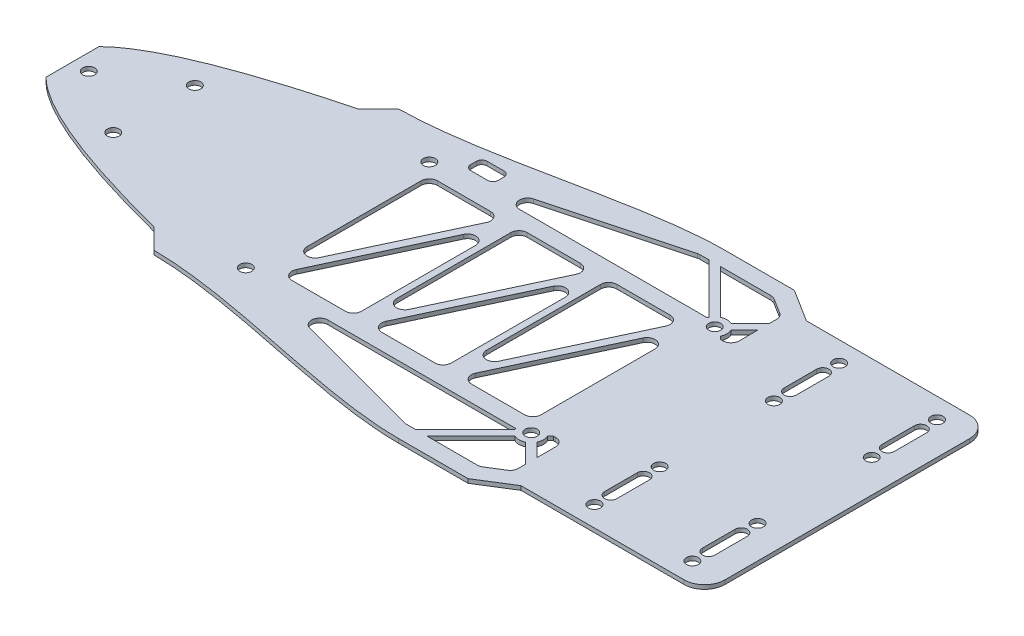
from build123d import *

# Parameters (mm, degrees)
EXTRUDE_2378_DEPTH     = 1
CUT_EXTRUDE_3502_DEPTH = 104.082491239
SKETCH_3_R             = 1.475
CUT_EXTRUDE_3584_DEPTH = 104.082491371
SKETCH_5_R             = 1.475
CUT_EXTRUDE_3823_DEPTH = 3
CUT_EXTRUDE_4012_REACH = 105.082
SKETCH_6_R             = 1.475
CUT_EXTRUDE_1_DEPTH    = 104.082491371
CUT_EXTRUDE_2_DEPTH    = 104.082491371
CUT_EXTRUDE_7505_DEPTH = 104.082491371


with BuildPart() as part:
    # Эскиз1 → Extrude 2378 (new body)
    with BuildSketch(Plane(origin=(0, 0, 0), x_dir=(1, 0, 0), z_dir=(0, 1, 0))):
        Polygon((50, -35), (95, -35), (95, 35), (50, 35), (42, 40), (-95, 40), (-95, -40), (42, -40), align=None)
    extrude(amount=EXTRUDE_2378_DEPTH)

    # Эскиз2 → Cut-Extrude 3502 (cut, through all)
    with BuildSketch(Plane(origin=(0, 0, 0), x_dir=(1, 0, 0), z_dir=(0, 1, 0))):
        with BuildLine():
            add(Edge.make_bspline(
                [(-50, -25.026666558), (-85.732219921, -15.758886483), (-94.999999998, -6.491106408)],
                knots=[0.187166668, 0.187166668, 0.187166668, 0.41886117, 0.41886117, 0.41886117], degree=2))
            Line((-95, -6.49110641), (-95, -40))
            Line((-95, -40), (25, -40))
            add(Edge.make_bspline(
                [(-45, -30), (-23.383121048, -30.26155873), (4.780404795, -40), (25, -40)],
                knots=[0, 0, 0, 0, 1, 1, 1, 1], degree=3))
            Line((-45, -30), (-50, -25.026666559))
        make_face()
        with BuildLine():
            Line((-95, 40), (-95, 6.49110641))
            add(Edge.make_bspline(
                [(-94.999999998, 6.491106408), (-85.732219921, 15.758886483), (-50, 25.026666558)],
                knots=[0.58113883, 0.58113883, 0.58113883, 0.812833332, 0.812833332, 0.812833332], degree=2))
            Line((-50, 25.026666559), (-45, 30))
            add(Edge.make_bspline(
                [(-45, 30), (-23.383121048, 30.26155873), (4.780404795, 40), (25, 40)],
                knots=[0, 0, 0, 0, 1, 1, 1, 1], degree=3))
            Line((25, 40), (-95, 40))
        make_face()
    extrude(amount=CUT_EXTRUDE_3502_DEPTH, mode=Mode.SUBTRACT)

    # Эскиз3 → Cut-Extrude 3584 (cut, through all)
    with BuildSketch(Plane(origin=(0, 0, 0), x_dir=(1, 0, 0), z_dir=(0, 1, 0))):
        with Locations((63, 30)):
            Circle(SKETCH_3_R)
        with Locations((63, 14)):
            Circle(SKETCH_3_R)
        with Locations((87, 14)):
            Circle(SKETCH_3_R)
        with Locations((87, 30)):
            Circle(SKETCH_3_R)
        with Locations((87, -14)):
            Circle(SKETCH_3_R)
        with Locations((87, -30)):
            Circle(SKETCH_3_R)
        with Locations((63, -14)):
            Circle(SKETCH_3_R)
        with Locations((63, -30)):
            Circle(SKETCH_3_R)
        with BuildLine():
            Line((64.5, 26), (64.5, 18))
            ThreePointArc((64.5, 18), (63, 16.5), (61.5, 18))
            Line((61.5, 18), (61.5, 26))
            ThreePointArc((61.5, 26), (63, 27.5), (64.5, 26))
        make_face()
        with BuildLine():
            Line((85.5, 26), (85.5, 18))
            ThreePointArc((85.5, 18), (87, 16.5), (88.5, 18))
            Line((88.5, 18), (88.5, 26))
            ThreePointArc((88.5, 26), (87, 27.5), (85.5, 26))
        make_face()
        with BuildLine():
            Line((64.5, -26), (64.5, -18))
            ThreePointArc((64.5, -18), (63, -16.5), (61.5, -18))
            Line((61.5, -18), (61.5, -26))
            ThreePointArc((61.5, -26), (63, -27.5), (64.5, -26))
        make_face()
        with BuildLine():
            Line((85.5, -26), (85.5, -18))
            ThreePointArc((85.5, -18), (87, -16.5), (88.5, -18))
            Line((88.5, -18), (88.5, -26))
            ThreePointArc((88.5, -26), (87, -27.5), (85.5, -26))
        make_face()
        with BuildLine():
            Line((95, -35), (95, -30))
            ThreePointArc((95, -30), (93.535533906, -33.535533906), (90, -35))
            Line((90, -35), (95, -35))
        make_face()
        with BuildLine():
            Line((95, 35), (90, 35))
            ThreePointArc((90, 35), (93.535533906, 33.535533906), (95, 30))
            Line((95, 30), (95, 35))
        make_face()
    extrude(amount=CUT_EXTRUDE_3584_DEPTH, mode=Mode.SUBTRACT)

    # Эскиз5 → Cut-Extrude 3823 (cut)
    with BuildSketch(Plane(origin=(0, 0, 0), x_dir=(1, 0, 0), z_dir=(0, 1, 0))):
        with Locations((-75, 10)):
            Circle(SKETCH_5_R)
        with Locations((-75, -10)):
            Circle(SKETCH_5_R)
        with Locations((-91, 0)):
            Circle(SKETCH_5_R)
    extrude(amount=CUT_EXTRUDE_3823_DEPTH, mode=Mode.SUBTRACT)

    # Эскиз6 → Cut-Extrude 4012 (cut, up to next)
    with BuildSketch(Plane(origin=(0, 0, 0), x_dir=(1, 0, 0), z_dir=(0, 1, 0)), mode=Mode.PRIVATE) as cut_extrude_4012_sk1:
        with Locations((-30, 22.5)):
            Circle(SKETCH_6_R)
    cut_extrude_4012_tool1 = extrude(cut_extrude_4012_sk1.sketch, amount=CUT_EXTRUDE_4012_REACH, mode=Mode.PRIVATE) & part.part
    # Эскиз6 → Cut-Extrude 4012 (cut, up to next)
    with BuildSketch(Plane(origin=(0, 0, 0), x_dir=(1, 0, 0), z_dir=(0, 1, 0)), mode=Mode.PRIVATE) as cut_extrude_4012_sk2:
        with Locations((40, 22.5)):
            Circle(SKETCH_6_R)
    cut_extrude_4012_tool2 = extrude(cut_extrude_4012_sk2.sketch, amount=CUT_EXTRUDE_4012_REACH, mode=Mode.PRIVATE) & part.part
    # Эскиз6 → Cut-Extrude 4012 (cut, up to next)
    with BuildSketch(Plane(origin=(0, 0, 0), x_dir=(1, 0, 0), z_dir=(0, 1, 0)), mode=Mode.PRIVATE) as cut_extrude_4012_sk3:
        with Locations((40, -22.5)):
            Circle(SKETCH_6_R)
    cut_extrude_4012_tool3 = extrude(cut_extrude_4012_sk3.sketch, amount=CUT_EXTRUDE_4012_REACH, mode=Mode.PRIVATE) & part.part
    # Эскиз6 → Cut-Extrude 4012 (cut, up to next)
    with BuildSketch(Plane(origin=(0, 0, 0), x_dir=(1, 0, 0), z_dir=(0, 1, 0)), mode=Mode.PRIVATE) as cut_extrude_4012_sk4:
        with Locations((-30, -22.5)):
            Circle(SKETCH_6_R)
    cut_extrude_4012_tool4 = extrude(cut_extrude_4012_sk4.sketch, amount=CUT_EXTRUDE_4012_REACH, mode=Mode.PRIVATE) & part.part
    add(cut_extrude_4012_tool1.solids().sort_by_distance((-30, 0, -22.5))[0], mode=Mode.SUBTRACT)
    add(cut_extrude_4012_tool2.solids().sort_by_distance((40, 0, -22.5))[0], mode=Mode.SUBTRACT)
    add(cut_extrude_4012_tool3.solids().sort_by_distance((40, 0, 22.5))[0], mode=Mode.SUBTRACT)
    add(cut_extrude_4012_tool4.solids().sort_by_distance((-30, 0, 22.5))[0], mode=Mode.SUBTRACT)

    # Эскиз7 → Облегчение 1 (cut, through all)
    with BuildSketch(Plane(origin=(0, 0, 0), x_dir=(1, 0, 0), z_dir=(0, 1, 0))):
        with BuildLine():
            Line((-8.607245494, -19.5), (-21.653873008, -19.5))
            ThreePointArc((-21.653873008, -19.5), (-23.340655899, -18.574599217), (-23.466488582, -16.654763477))
            Line((-23.466488582, -16.654763477), (-10.419861068, 11.323819516))
            ThreePointArc((-10.419861068, 11.323819516), (-8.174366266, 12.431175007), (-6.607245494, 10.478582993))
            Line((-6.607245494, 10.478582993), (-6.607245494, -17.5))
            ThreePointArc((-6.607245494, -17.5), (-7.193031932, -18.914213562), (-8.607245494, -19.5))
        make_face()
        with BuildLine():
            Line((-11.953372486, 19.5), (-25, 19.5))
            ThreePointArc((-25, 19.5), (-26.414213562, 18.914213562), (-27, 17.5))
            Line((-27, 17.5), (-27, -10.478582993))
            ThreePointArc((-27, -10.478582993), (-25.432879228, -12.431175007), (-23.187384426, -11.323819516))
            Line((-23.187384426, -11.323819516), (-10.140756912, 16.654763477))
            ThreePointArc((-10.140756912, 16.654763477), (-10.266589595, 18.574599217), (-11.953372486, 19.5))
        make_face()
        with BuildLine():
            Line((-5, -10.478582993), (-5, 17.5))
            ThreePointArc((-5, 17.5), (-4.414213562, 18.914213562), (-3, 19.5))
            Line((-3, 19.5), (10.046627514, 19.5))
            ThreePointArc((10.046627514, 19.5), (11.733410405, 18.574599217), (11.859243088, 16.654763477))
            Line((11.859243088, 16.654763477), (-1.187384426, -11.323819516))
            ThreePointArc((-1.187384426, -11.323819516), (-3.432879228, -12.431175007), (-5, -10.478582993))
        make_face()
        with BuildLine():
            Line((11.580138932, 11.323819516), (-1.466488582, -16.654763477))
            ThreePointArc((-1.466488582, -16.654763477), (-1.340655899, -18.574599217), (0.346126992, -19.5))
            Line((0.346126992, -19.5), (13.392754506, -19.5))
            ThreePointArc((13.392754506, -19.5), (14.806968068, -18.914213562), (15.392754506, -17.5))
            Line((15.392754506, -17.5), (15.392754506, 10.478582993))
            ThreePointArc((15.392754506, 10.478582993), (13.825633734, 12.431175007), (11.580138932, 11.323819516))
        make_face()
        with BuildLine():
            Line((17, -10.478582993), (17, 17.5))
            ThreePointArc((17, 17.5), (17.585786438, 18.914213562), (19, 19.5))
            Line((19, 19.5), (32.046627514, 19.5))
            ThreePointArc((32.046627514, 19.5), (33.733410405, 18.574599217), (33.859243088, 16.654763477))
            Line((33.859243088, 16.654763477), (20.812615574, -11.323819516))
            ThreePointArc((20.812615574, -11.323819516), (18.567120772, -12.431175007), (17, -10.478582993))
        make_face()
        with BuildLine():
            Line((33.580138932, 11.323819516), (20.533511418, -16.654763477))
            ThreePointArc((20.533511418, -16.654763477), (20.659344101, -18.574599217), (22.346126992, -19.5))
            Line((22.346126992, -19.5), (35.392754506, -19.5))
            ThreePointArc((35.392754506, -19.5), (36.806968068, -18.914213562), (37.392754506, -17.5))
            Line((37.392754506, -17.5), (37.392754506, 10.478582993))
            ThreePointArc((37.392754506, 10.478582993), (35.825633734, 12.431175007), (33.580138932, 11.323819516))
        make_face()
    extrude(amount=CUT_EXTRUDE_1_DEPTH, mode=Mode.SUBTRACT)

    # Эскиз8 → Облегчение 2 (cut, through all)
    with BuildSketch(Plane(origin=(0, 0, 0), x_dir=(1, 0, 0), z_dir=(0, 1, 0))):
        with BuildLine():
            Line((-8.872202344, 23.5), (37.171572875, 23.5))
            ThreePointArc((37.171572875, 23.5), (37.228361402, 23.648050297), (37.292893219, 23.792893219))
            Line((37.292893219, 23.792893219), (25.085786438, 36))
            Line((25.085786438, 36), (22.85022952, 36))
            ThreePointArc((22.85022952, 36), (22.589177136, 35.982889723), (22.33259143, 35.931851653))
            Line((22.33259143, 35.931851653), (-9.389840434, 27.431851653))
            ThreePointArc((-9.389840434, 27.431851653), (-10.855092067, 25.238947616), (-8.872202344, 23.5))
        make_face()
        with BuildLine():
            Line((27.914213562, 36), (38.707106781, 25.207106781))
            ThreePointArc((38.707106781, 25.207106781), (40, 25.5), (41.292893219, 25.207106781))
            Line((41.292893219, 25.207106781), (46, 29.914213562))
            Line((46, 29.914213562), (46, 31.674514151))
            ThreePointArc((46, 31.674514151), (45.749284962, 32.644051216), (45.05999788, 33.370510759))
            Line((45.05999788, 33.370510759), (41.339220522, 35.695996608))
            ThreePointArc((41.339220522, 35.695996608), (40.830587668, 35.922497492), (40.279222642, 36))
            Line((40.279222642, 36), (27.914213562, 36))
        make_face()
        with BuildLine():
            Line((42.707106781, 21.207106781), (43.414213562, 20.5))
            Line((43.414213562, 20.5), (44, 20.5))
            ThreePointArc((44, 20.5), (45.414213562, 21.085786438), (46, 22.5))
            Line((46, 22.5), (46, 27.085786438))
            Line((46, 27.085786438), (42.707106781, 23.792893219))
            ThreePointArc((42.707106781, 23.792893219), (43, 22.5), (42.707106781, 21.207106781))
        make_face()
        with BuildLine():
            ThreePointArc((45.05999788, -33.370510759), (45.749284962, -32.644051216), (46, -31.674514151))
            Line((46, -31.674514151), (46, -29.914213562))
            Line((46, -29.914213562), (41.292893219, -25.207106781))
            ThreePointArc((41.292893219, -25.207106781), (40, -25.5), (38.707106781, -25.207106781))
            Line((38.707106781, -25.207106781), (27.914213562, -36))
            Line((27.914213562, -36), (40.279222642, -36))
            ThreePointArc((40.279222642, -36), (40.830587668, -35.922497492), (41.339220522, -35.695996608))
            Line((41.339220522, -35.695996608), (45.05999788, -33.370510759))
        make_face()
        with BuildLine():
            Line((42.707106781, -23.792893219), (46, -27.085786438))
            Line((46, -27.085786438), (46, -22.5))
            ThreePointArc((46, -22.5), (45.414213562, -21.085786438), (44, -20.5))
            Line((44, -20.5), (43.414213562, -20.5))
            Line((43.414213562, -20.5), (42.707106781, -21.207106781))
            ThreePointArc((42.707106781, -21.207106781), (43, -22.5), (42.707106781, -23.792893219))
        make_face()
        with BuildLine():
            Line((25.085786438, -36), (37.292893219, -23.792893219))
            ThreePointArc((37.292893219, -23.792893219), (37.228361402, -23.648050297), (37.171572875, -23.5))
            Line((37.171572875, -23.5), (-8.872202344, -23.5))
            ThreePointArc((-8.872202344, -23.5), (-10.855092067, -25.238947616), (-9.389840434, -27.431851653))
            Line((-9.389840434, -27.431851653), (22.33259143, -35.931851653))
            ThreePointArc((22.33259143, -35.931851653), (22.589177136, -35.982889723), (22.85022952, -36))
            Line((22.85022952, -36), (25.085786438, -36))
        make_face()
    extrude(amount=CUT_EXTRUDE_2_DEPTH, mode=Mode.SUBTRACT)

    # Эскиз10 → Cut-Extrude 7505 (cut, through all)
    with BuildSketch(Plane(origin=(0, 1, 0), x_dir=(1, 0, 0), z_dir=(0, 1, 0))):
        with BuildLine():
            ThreePointArc((-23.1, 29.74517), (-23.998025612, 29.373195612), (-24.37, 28.47517))
            Line((-24.37, 28.47517), (-24.37, 27.01517))
            ThreePointArc((-24.37, 27.01517), (-23.998025612, 26.117144388), (-23.1, 25.74517))
            Line((-23.1, 25.74517), (-18.909, 25.74517))
            ThreePointArc((-18.909, 25.74517), (-18.010974388, 26.117144388), (-17.639, 27.01517))
            Line((-17.639, 27.01517), (-17.639, 28.47517))
            ThreePointArc((-17.639, 28.47517), (-18.010974388, 29.373195612), (-18.909, 29.74517))
            Line((-18.909, 29.74517), (-23.1, 29.74517))
        make_face()
    extrude(amount=-CUT_EXTRUDE_7505_DEPTH, mode=Mode.SUBTRACT)


solid = part.part
